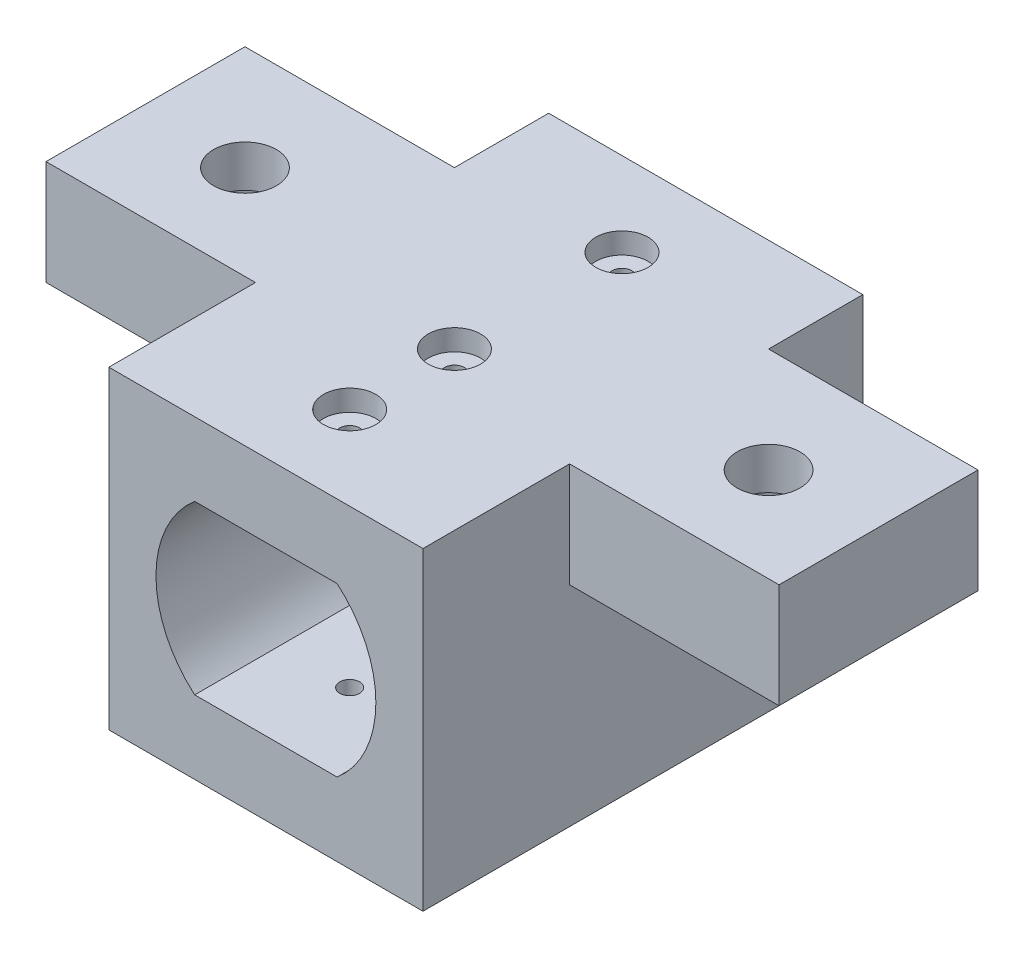
from build123d import *
from build123d.topology import SkipClean

# Parameters (mm, degrees)
SKETCH_1_W          = 30
SKETCH_1_H          = 30
SKETCH_1_R          = 10.5
EXTRUDE_1_DEPTH     = 17
SKETCH_2_W          = 30
SKETCH_2_H          = 30
EXTRUDE_2_DEPTH     = 25
SKETCH_3_R          = 0.95
CUT_EXTRUDE_1_DEPTH = 54.749418602
SKETCH_4_R          = 2.5
CUT_EXTRUDE_2_DEPTH = 2
CUT_EXTRUDE_START   = -2
SKETCH_5_R          = 2.5
CUT_EXTRUDE_3_DEPTH = 2
SKETCH_6_W          = 19
SKETCH_6_H          = 10
EXTRUDE_5_DEPTH     = 20
SKETCH_8_W          = 19
SKETCH_8_H          = 10
EXTRUDE_6_DEPTH     = 20
SKETCH_9_R          = 3
CUT_EXTRUDE_4_DEPTH = 10
SKETCH_10_R         = 4.5
CUT_EXTRUDE_5_DEPTH = 6


with BuildPart() as part:
    # 草图1 → 凸台-拉伸1 (new body)
    with BuildSketch(Plane.XY):
        Rectangle(SKETCH_1_W, SKETCH_1_H)
        Circle(SKETCH_1_R, mode=Mode.SUBTRACT)
    extrude(amount=EXTRUDE_1_DEPTH)

    # 草图2 → 凸台-拉伸2 (add)
    with SkipClean():  # the faces are left unmerged after this step: merging them gives an invalid solid
        with BuildSketch(Plane.XY.offset(17)):
            Rectangle(SKETCH_2_W, SKETCH_2_H)
            with BuildLine():
                Line((-6.800735254, 8), (6.800735254, 8))
                ThreePointArc((6.800735254, 8), (10.5, 0), (6.800735254, -8))
                Line((6.800735254, -8), (-6.800735254, -8))
                ThreePointArc((-6.800735254, -8), (-10.5, 0), (-6.800735254, 8))
            make_face(mode=Mode.SUBTRACT)
        extrude(amount=EXTRUDE_2_DEPTH)

    # 草图3 → 切除-拉伸1 (cut, through all)
    with SkipClean():  # the faces are left unmerged after this step: merging them gives an invalid solid
        with BuildSketch(Plane(origin=(0, 15, 0), x_dir=(1, 0, 0), z_dir=(0, 1, 0))):
            with Locations(Location((0, -34, 0), (0, 0, 270))):
                Circle(SKETCH_3_R)
            with Locations(Location((0, -8, 0), (0, 0, 270))):
                Circle(SKETCH_3_R)
            with Locations(Location((0, -24, 0), (0, 0, 270))):
                Circle(SKETCH_3_R)
        extrude(amount=-CUT_EXTRUDE_1_DEPTH, mode=Mode.SUBTRACT)

    # 草图4 → 切除-拉伸2 (cut)
    with SkipClean():  # the faces are left unmerged after this step: merging them gives an invalid solid
        with BuildSketch(Plane(origin=(0, 15, 0), x_dir=(1, 0, 0), z_dir=(0, 1, 0))):
            with Locations(Location((0, -8, 0), (0, 0, 270))):
                Circle(SKETCH_4_R)
            with Locations(Location((0, -24, 0), (0, 0, 270))):
                Circle(SKETCH_4_R)
            with Locations(Location((0, -34, 0), (0, 0, 270))):
                Circle(SKETCH_4_R)
        extrude(amount=-CUT_EXTRUDE_2_DEPTH, mode=Mode.SUBTRACT)

    # 草图5 → 切除-拉伸3 (cut)
    with SkipClean():  # the faces are left unmerged after this step: merging them gives an invalid solid
        with BuildSketch(Plane.XZ.offset(15).offset(CUT_EXTRUDE_START)):
            with Locations(Location((0, 34, 0), (0, 0, 90))):
                Circle(SKETCH_5_R)
            with Locations(Location((0, 24, 0), (0, 0, 90))):
                Circle(SKETCH_5_R)
            with Locations(Location((0, 8, 0), (0, 0, 90))):
                Circle(SKETCH_5_R)
        extrude(amount=CUT_EXTRUDE_3_DEPTH, mode=Mode.SUBTRACT)

    # 草图6 → 凸台-拉伸5 (add)
    with SkipClean():  # the faces are left unmerged after this step: merging them gives an invalid solid
        with BuildSketch(Plane.ZY.offset(15)):
            with Locations((18.5, 10)):
                Rectangle(SKETCH_6_W, SKETCH_6_H)
        extrude(amount=EXTRUDE_5_DEPTH)

    # 草图8 → 凸台-拉伸6 (add)
    with SkipClean():  # the faces are left unmerged after this step: merging them gives an invalid solid
        with BuildSketch(Plane(origin=(15, 0, 0), x_dir=(0, 0, -1), z_dir=(1, 0, 0))):
            with Locations((-18.5, 10)):
                Rectangle(SKETCH_8_W, SKETCH_8_H)
        extrude(amount=EXTRUDE_6_DEPTH)

    # 草图9 → 切除-拉伸4 (cut)
    with SkipClean():  # the faces are left unmerged after this step: merging them gives an invalid solid
        with BuildSketch(Plane.XZ.offset(-5)):
            with Locations(Location((-25, 19, 0), (0, 0, 270))):
                Circle(SKETCH_9_R)
            with Locations(Location((25, 19, 0), (0, 0, 270))):
                Circle(SKETCH_9_R)
        extrude(amount=-CUT_EXTRUDE_4_DEPTH, mode=Mode.SUBTRACT)

    # 草图10 → 切除-拉伸5 (cut)
    with SkipClean():  # the faces are left unmerged after this step: merging them gives an invalid solid
        with BuildSketch(Plane.XZ.offset(-5)):
            with Locations(Location((-25, 19, 0), (0, 0, 270))):
                Circle(SKETCH_10_R)
            with Locations(Location((25, 19, 0), (0, 0, 270))):
                Circle(SKETCH_10_R)
        extrude(amount=-CUT_EXTRUDE_5_DEPTH, mode=Mode.SUBTRACT)


solid = part.part
